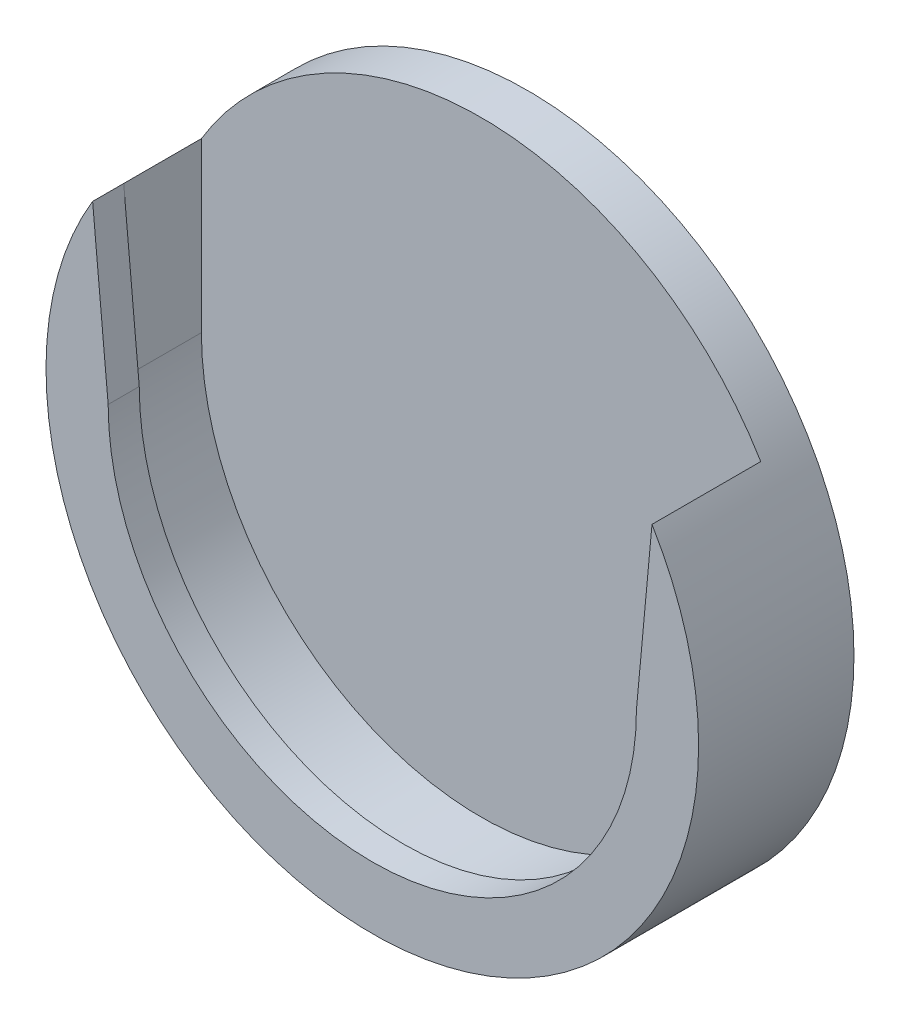
from build123d import *

# Parameters (mm, degrees)
ESBO_O1_R                = 21
RESSALTO_EXTRUS_O1_DEPTH = 3
RESSALTO_EXTRUS_O2_START = 5
RESSALTO_EXTRUS_O2_DEPTH = 5
RESSALTO_EXTRUS_O3_START = 2
RESSALTO_EXTRUS_O3_DEPTH = 2


with BuildPart() as part:
    # Esboço1 → Ressalto-extrusão1 (new body)
    with BuildSketch(Plane.XY):
        Circle(ESBO_O1_R)
    extrude(amount=-RESSALTO_EXTRUS_O1_DEPTH)

    # Esboço1<3> → Ressalto-extrusão2 (add)
    with BuildSketch(Plane.XY.offset(RESSALTO_EXTRUS_O2_START)):
        with BuildLine():
            ThreePointArc((18, 0), (0, -18), (-18, 0))
            Line((-18, 0), (-18, 10.816653826))
            ThreePointArc((-18, 10.816653826), (-5.61248608, -20.236106345), (21, 0))
            ThreePointArc((21, 0), (20.236106345, 5.61248608), (18, 10.816653826))
            Line((18, 10.816653826), (18, 0))
        make_face()
    extrude(amount=-RESSALTO_EXTRUS_O2_DEPTH)

    # Esboço3 → Ressalto-extrusão3 (add)
    with BuildSketch(Plane.XY.offset(5).offset(RESSALTO_EXTRUS_O3_START)):
        with BuildLine():
            Line((18, 10.816653826), (17, 0))
            ThreePointArc((17, 0), (0, -17), (-17, 0))
            Line((-17, 0), (-18, 10.816653826))
            ThreePointArc((-18, 10.816653826), (0, -21), (18, 10.816653826))
        make_face()
    extrude(amount=-RESSALTO_EXTRUS_O3_DEPTH)


solid = part.part
